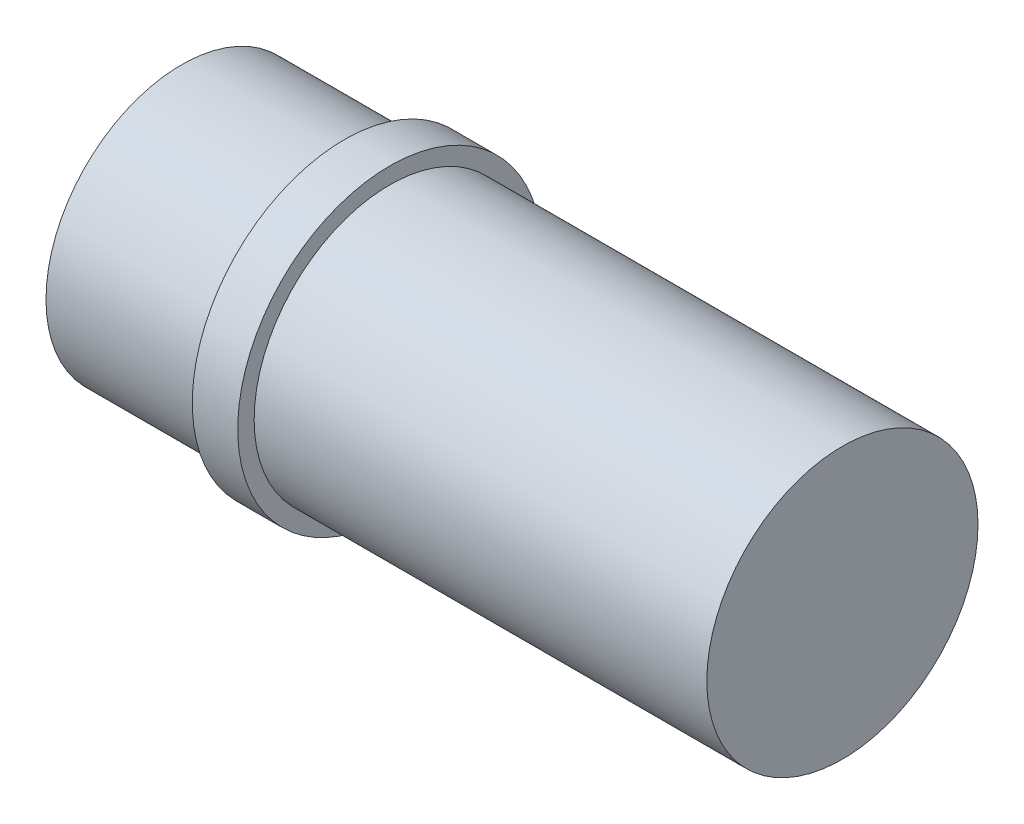
from build123d import *

# Parameters (mm, degrees)
SKETCH1_R           = 12.5
BOSS_EXTRUDE1_DEPTH = 15
SCALE1_SCALE        = 1.9329
SCALE2_SCALE        = 1.5
SKETCH3_R           = 40.633377722
BOSS_EXTRUDE2_DEPTH = 12.1499924
SKETCH4_R           = 36.241875
BOSS_EXTRUDE3_DEPTH = 50
SKETCH5_R           = 36.241875
BOSS_EXTRUDE4_DEPTH = 71


with BuildPart() as part:
    # Sketch1 → Boss-Extrude1 (new body)
    with BuildSketch(Plane(origin=(0, 0, 0), x_dir=(0, 0, -1), z_dir=(1, 0, 0))):
        Circle(SKETCH1_R)
    extrude(amount=BOSS_EXTRUDE1_DEPTH)


with BuildPart() as part_1:
    # Scale1: scaled about (7.5, 0, 0)
    add(part.part.scale(SCALE1_SCALE).moved(Location((-6.99675, 0, 0))))


with BuildPart() as part_2:
    # Scale2: scaled about (7.5, 0, 0)
    add(part_1.part.scale(SCALE2_SCALE).moved(Location((-3.75, 0, 0))))

    # Sketch3 → Boss-Extrude2 (add)
    with BuildSketch(Plane(origin=(29.245125, 0, 0), x_dir=(0, 0, -1), z_dir=(1, 0, 0))):
        Circle(SKETCH3_R)
    extrude(amount=BOSS_EXTRUDE2_DEPTH)

    # Sketch4 → Boss-Extrude3 (add)
    with BuildSketch(Plane(origin=(41.3951174, 0, 0), x_dir=(0, 0, -1), z_dir=(1, 0, 0))):
        Circle(SKETCH4_R)
    extrude(amount=BOSS_EXTRUDE3_DEPTH)

    # Sketch5 → Boss-Extrude4 (add)
    with BuildSketch(Plane(origin=(91.3951174, 0, 0), x_dir=(0, 0, -1), z_dir=(1, 0, 0))):
        Circle(SKETCH5_R)
    extrude(amount=BOSS_EXTRUDE4_DEPTH)


solid = part_2.part
